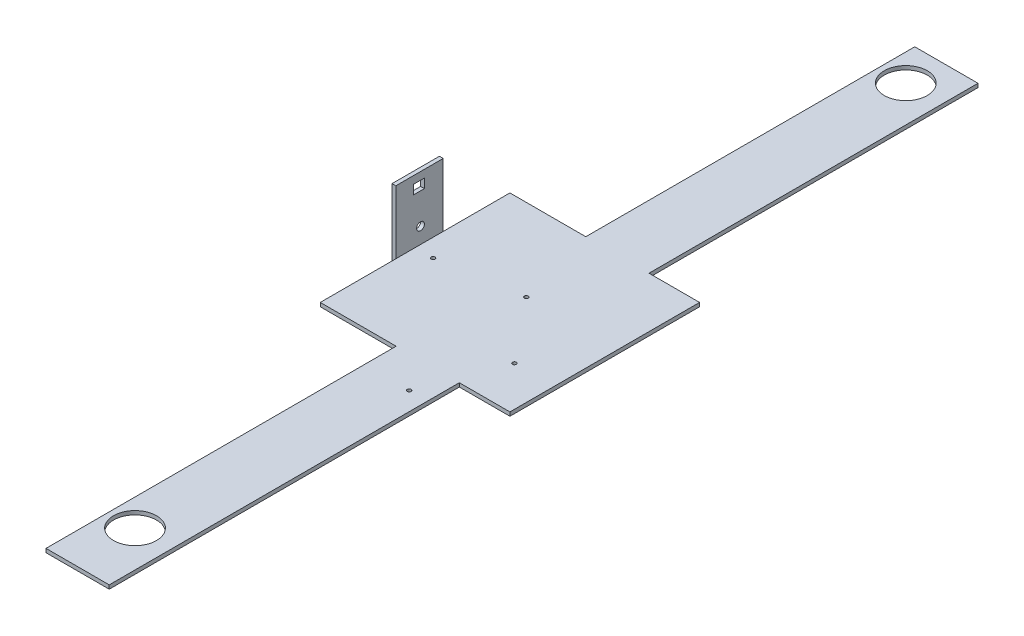
from build123d import *

# Parameters (mm, degrees)
SKETCH1_R           = 17
BOSS_EXTRUDE1_DEPTH = 3
SKETCH3_W           = 37.520369423
SKETCH3_H           = 53
SKETCH3_R           = 3.081115769
SKETCH3_W_2         = 8.431940609
SKETCH3_H_2         = 7.24288365
BOSS_EXTRUDE2_DEPTH = 3
SKETCH2_R           = 1.5
CUT_EXTRUDE1_DEPTH  = 3


with BuildPart() as part:
    # Sketch1 → Boss-Extrude1 (new body)
    with BuildSketch(Plane(origin=(0, 0, 0), x_dir=(1, 0, 0), z_dir=(0, 1, 0))):
        Polygon((-140.450145292, 142.201168563), (-100.450145292, 142.201168563), (-100.450145292, -7.798831437), (-140.450145292, -7.798831437), (-140.450145292, -284.717952364), (-190.450145292, -284.717952364), (-190.450145292, -7.798831437), (-250.450145292, -7.798831437), (-250.450145292, 142.201168563), (-200.450145292, 142.201168563), (-190.450145292, 142.201168563), (-190.450145292, 402.408103705), (-140.450145292, 402.408103705), align=None)
        with Locations(Location((-169.10841193, 373.953530137, 0), (0, 0, 270))):
            Circle(SKETCH1_R, mode=Mode.SUBTRACT)
        with Locations(Location((-169.10841193, -235.646469863, 0), (0, 0, 270))):
            Circle(SKETCH1_R, mode=Mode.SUBTRACT)
    extrude(amount=BOSS_EXTRUDE1_DEPTH)

    # Sketch3 → Boss-Extrude2 (add)
    with BuildSketch(Plane.ZY.offset(250.450145292)):
        with Locations((-70.700585856, 26.5)):
            Rectangle(SKETCH3_W, SKETCH3_H)
        with Locations((-71.485173946, 15.517365386)):
            Circle(SKETCH3_R, mode=Mode.SUBTRACT)
        with Locations((-70.350319411, 43.392750381)):
            Rectangle(SKETCH3_W_2, SKETCH3_H_2, mode=Mode.SUBTRACT)
    extrude(amount=BOSS_EXTRUDE2_DEPTH)

    # Sketch2 → Cut-Extrude1 (cut)
    with BuildSketch(Plane(origin=(0, 3, 0), x_dir=(1, 0, 0), z_dir=(0, 1, 0))):
        with Locations(Location((-236.200145292, 67.201168563, 0), (0, 0, 270))):
            Circle(SKETCH2_R)
        with Locations(Location((-172.579411925, 77.325298746, 0), (0, 0, 270))):
            Circle(SKETCH2_R)
        with Locations(Location((-132.001291312, 27.290192535, 0), (0, 0, 270))):
            Circle(SKETCH2_R)
        with Locations(Location((-155.043904065, -32.86904386, 0), (0, 0, 270))):
            Circle(SKETCH2_R)
        with Locations((-218.664637432, -42.993174043)):
            Circle(SKETCH2_R)
        with Locations((-259.242758045, 7.041932168)):
            Circle(SKETCH2_R)
    extrude(amount=-CUT_EXTRUDE1_DEPTH, mode=Mode.SUBTRACT)


solid = part.part
